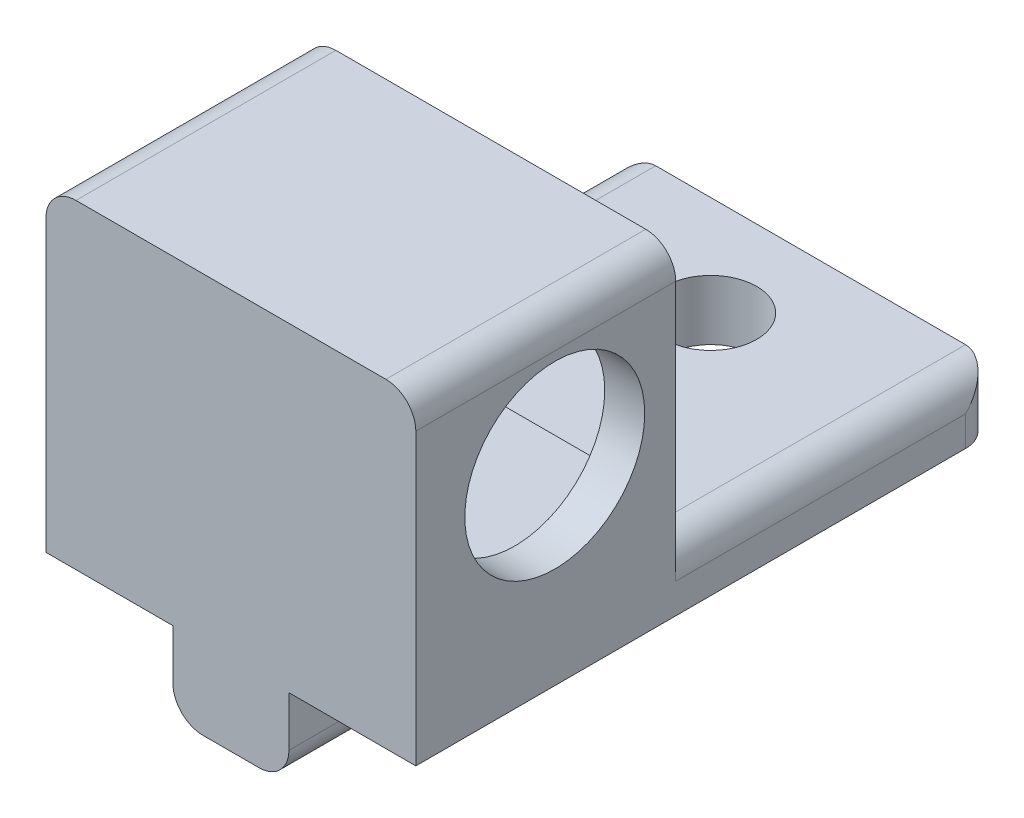
from build123d import *

# Parameters (mm, degrees)
SKETCH_1_W          = 18.5
SKETCH_1_H          = 13
EXTRUDE_1_DEPTH     = 13
SKETCH_2_R          = 4.5
CUT_EXTRUDE_1_DEPTH = 2
CUT_EXTRUDE_START   = -2
CUT_EXTRUDE_2_DEPTH = 14.9
SKETCH_3_W          = 3.5
SKETCH_3_H          = 9.5
CUT_EXTRUDE_3_DEPTH = 11.7
SKETCH_4_W          = 18.5
SKETCH_4_H          = 29
SKETCH_4_R          = 2.3
EXTRUDE_2_DEPTH     = 3
SKETCH_4_3_W        = 5.8
SKETCH_4_3_H        = 13
EXTRUDE_3_DEPTH     = 7
FILLET_1_R          = 1.5


with BuildPart() as part:
    # 草图1 → 凸台-拉伸1 (new body)
    with BuildSketch(Plane.XY):
        with Locations((7.25, 4.7)):
            Rectangle(SKETCH_1_W, SKETCH_1_H)
    extrude(amount=EXTRUDE_1_DEPTH)

    # 草图2 → 切除-拉伸1 (cut)
    with BuildSketch(Plane(origin=(16.5, 0, 0), x_dir=(0, 0, -1), z_dir=(1, 0, 0))):
        with Locations((-6.05, 4.75)):
            Circle(SKETCH_2_R)
    extrude(amount=-CUT_EXTRUDE_1_DEPTH, mode=Mode.SUBTRACT)

    # 草图2<3> → 切除-拉伸2 (cut)
    with BuildSketch(Plane(origin=(16.5, 0, 0), x_dir=(0, 0, -1), z_dir=(1, 0, 0)).offset(CUT_EXTRUDE_START)):
        with BuildLine():
            Line((0, 9.5), (-6.05, 9.5))
            ThreePointArc((-6.05, 9.5), (-10.8, 4.75), (-6.05, 0))
            Line((-6.05, 0), (0, 0))
            Line((0, 0), (0, 9.5))
        make_face()
    extrude(amount=-CUT_EXTRUDE_2_DEPTH, mode=Mode.SUBTRACT)

    # 草图3 → 切除-拉伸3 (cut)
    with BuildSketch(Plane(origin=(0, 0, 0), x_dir=(-1, 0, 0), z_dir=(0, 0, -1))):
        with Locations((-12.75, 4.75)):
            Rectangle(SKETCH_3_W, SKETCH_3_H)
    extrude(amount=-CUT_EXTRUDE_3_DEPTH, mode=Mode.SUBTRACT)

    # 草图4 → 凸台-拉伸2 (add)
    with BuildSketch(Plane(origin=(0, -1.8, 0), x_dir=(1, 0, 0), z_dir=(0, 1, 0))):
        with Locations((7.25, 1.5)):
            Rectangle(SKETCH_4_W, SKETCH_4_H)
        with Locations((7.25, 11)):
            Circle(SKETCH_4_R, mode=Mode.SUBTRACT)
    extrude(amount=-EXTRUDE_2_DEPTH)

    # 草图4<3> → 凸台-拉伸3 (add)
    with BuildSketch(Plane(origin=(0, -1.8, 0), x_dir=(1, 0, 0), z_dir=(0, 1, 0))):
        with Locations((7.25, -6.5)):
            Rectangle(SKETCH_4_3_W, SKETCH_4_3_H)
    extrude(amount=-EXTRUDE_3_DEPTH)

    # 圆角1
    fillet_1_edges = [part.edges().sort_by_distance(p)[0] for p in [
        (10.15, -8.8, 6.5),
        (4.35, -8.8, 6.5),
        (-2, -3.3, -16),
        (16.5, -3.3, -16),
        (-2, -1.8, -8),
        (16.5, -1.8, -8),
        (16.5, 11.2, 6.5),
        (-2, 11.2, 6.5),
    ]]
    fillet(fillet_1_edges, radius=FILLET_1_R)


solid = part.part
